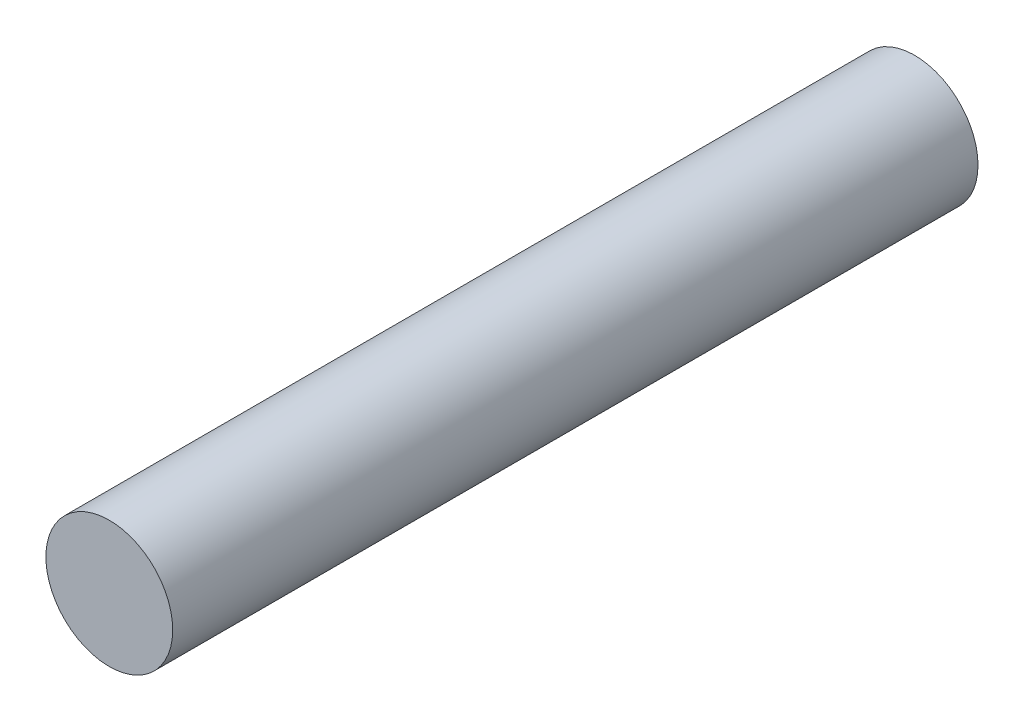
from build123d import *

# Parameters (mm, degrees)
SKETCH1_R           = 1
BOSS_EXTRUDE1_DEPTH = 12.7


with BuildPart() as part:
    # Sketch1 → Boss-Extrude1 (new body)
    with BuildSketch(Plane.XY):
        Circle(SKETCH1_R)
    extrude(amount=BOSS_EXTRUDE1_DEPTH)


solid = part.part
